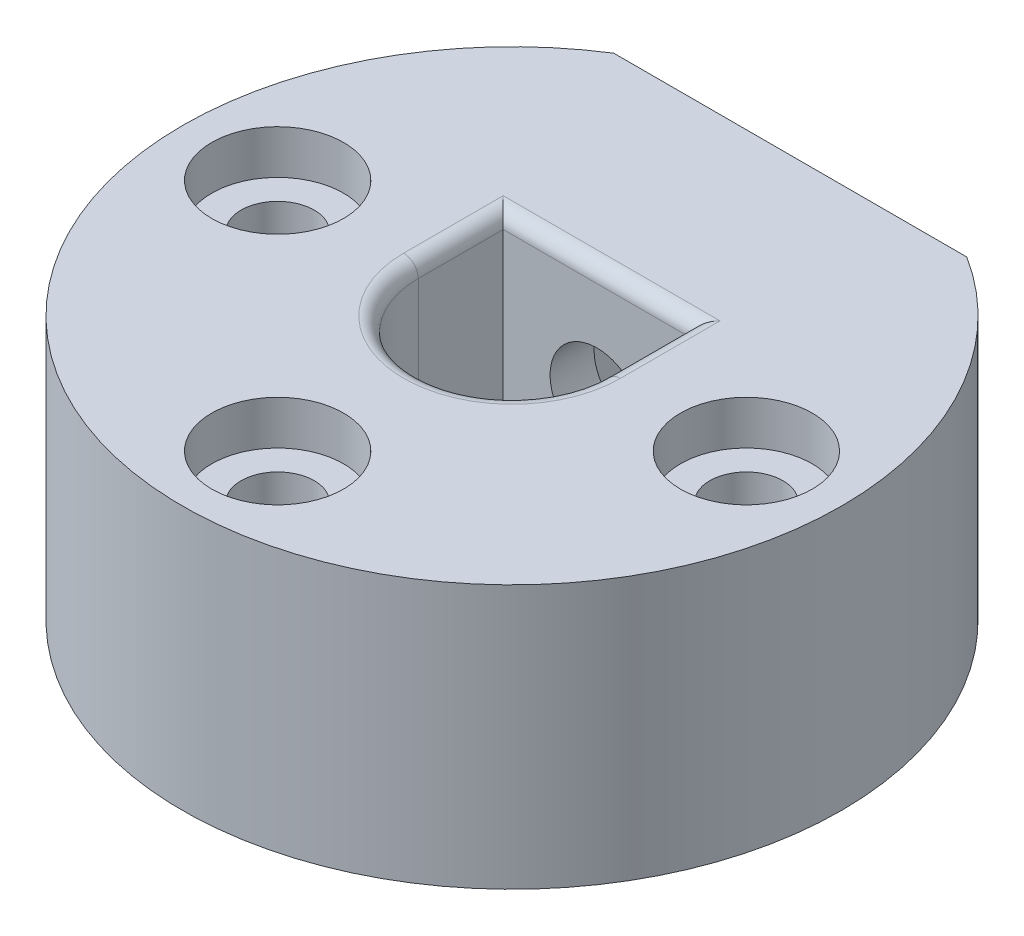
from build123d import *

# Parameters (mm, degrees)
BOSS_EXTRU_1_DEPTH                              = 9
CHAMBRAGE_POUR_VIS_T_TE_CYLINDRIQUE_D           = 2.5
CHAMBRAGE_POUR_VIS_T_TE_CYLINDRIQUE_CBORE_D     = 4.5
CHAMBRAGE_POUR_VIS_T_TE_CYLINDRIQUE_CBORE_DEPTH = 1.5
CONG_1_R                                        = 0.5
ESQUISSE6_R                                     = 1.6
ENL_V_MAT_EXTRU_1_DEPTH                         = 19.27908646
ESQUISSE7_W                                     = 5.85
ESQUISSE7_H                                     = 2.25
ENL_V_MAT_EXTRU_2_DEPTH                         = 7.25


with BuildPart() as part:
    # Esquisse1 → Boss.-Extru.1 (new body)
    with BuildSketch(Plane(origin=(0, 0, 0), x_dir=(1, 0, 0), z_dir=(0, 1, 0))):
        with BuildLine():
            Line((6.025985397, 9.5), (-6.025985397, 9.5))
            ThreePointArc((-6.025985397, 9.5), (0, -11.25), (6.025985397, 9.5))
        make_face()
        with BuildLine():
            Line((-3.2, 0), (-3.2, 2.9))
            Line((-3.2, 2.9), (3.2, 2.9))
            Line((3.2, 2.9), (3.2, 0))
            ThreePointArc((3.2, 0), (0, -3.2), (-3.2, 0))
        make_face(mode=Mode.SUBTRACT)
    extrude(amount=BOSS_EXTRU_1_DEPTH)

    # Chambrage pour vis à tête cylindrique à 6 pans creux (ou vis CHC) M21 (through all)
    with Locations(Plane(origin=(0, 9, 0), x_dir=(1, 0, 0), z_dir=(0, 1, 0))):
        with Locations((8, 0), (-8, 0), (0, 0), (0, -8)):
            CounterBoreHole(CHAMBRAGE_POUR_VIS_T_TE_CYLINDRIQUE_D / 2, CHAMBRAGE_POUR_VIS_T_TE_CYLINDRIQUE_CBORE_D / 2, CHAMBRAGE_POUR_VIS_T_TE_CYLINDRIQUE_CBORE_DEPTH)

    # Congé1
    cong_1_edges = [part.edges().sort_by_distance(p)[0] for p in [
        (0, 9, 3.2),
        (3.2, 9, -1.45),
        (0, 9, -2.9),
        (-3.2, 9, -1.45),
    ]]
    fillet(cong_1_edges, radius=CONG_1_R)

    # Esquisse6 → Enlèv. mat.-Extru.1 (cut, through all)
    with BuildSketch(Plane.XY):
        with Locations((0, 5)):
            Circle(ESQUISSE6_R)
    extrude(amount=-ENL_V_MAT_EXTRU_1_DEPTH, mode=Mode.SUBTRACT)

    # Esquisse7 → Enlèv. mat.-Extru.2 (cut)
    with BuildSketch(Plane(origin=(0, 0, 0), x_dir=(1, 0, 0), z_dir=(0, 1, 0))):
        with Locations((0, 5.525)):
            Rectangle(ESQUISSE7_W, ESQUISSE7_H)
    extrude(amount=ENL_V_MAT_EXTRU_2_DEPTH, mode=Mode.SUBTRACT)


solid = part.part
